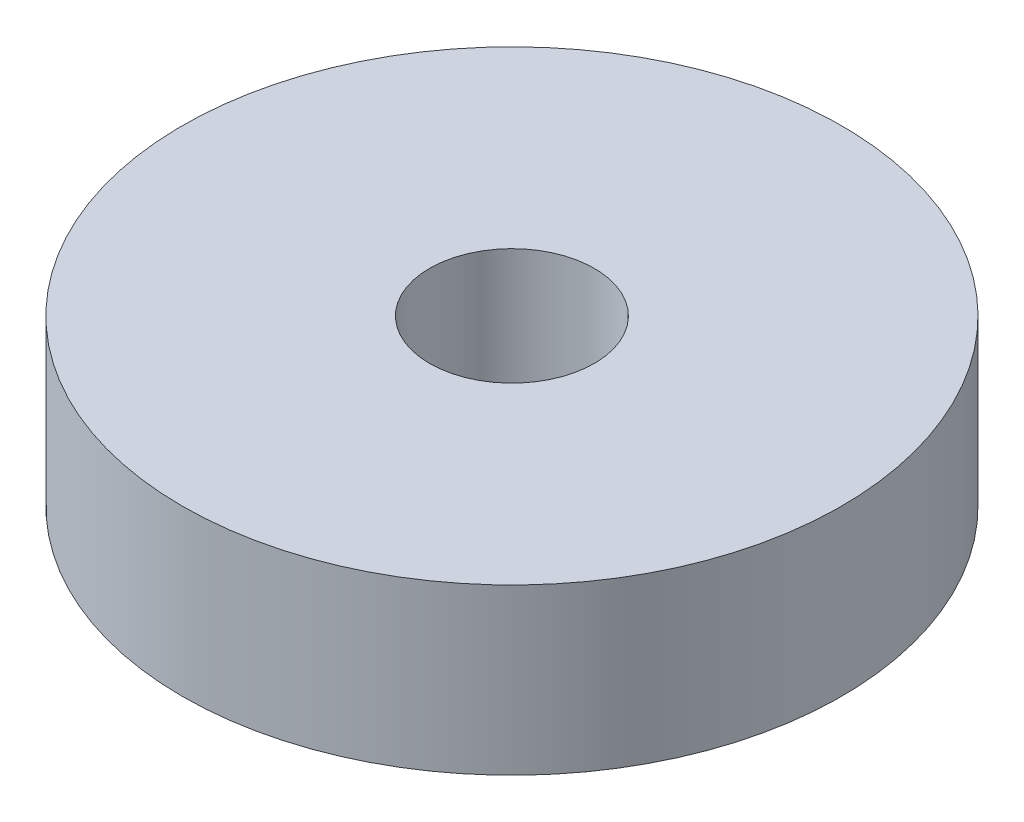
from build123d import *

# Parameters (mm, degrees)
SKETCH_1_R      = 10
SKETCH_1_R_2    = 2.5
EXTRUDE_1_DEPTH = 5


with BuildPart() as part:
    # 草图1 → 凸台-拉伸1 (new body)
    with BuildSketch(Plane(origin=(0, 0, 0), x_dir=(1, 0, 0), z_dir=(0, 1, 0))):
        with Locations(Location((0, 0, 0), (0, 0, 270))):
            Circle(SKETCH_1_R)
        with Locations(Location((0, 0, 0), (0, 0, 270))):
            Circle(SKETCH_1_R_2, mode=Mode.SUBTRACT)
    extrude(amount=EXTRUDE_1_DEPTH)


solid = part.part
